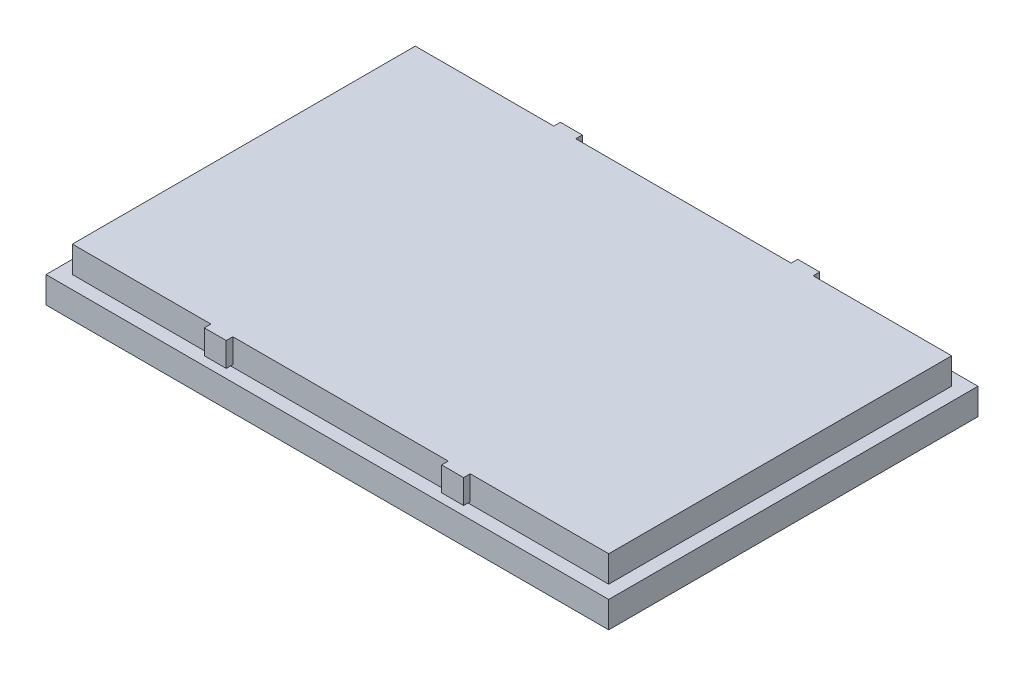
from build123d import *

# Parameters (mm, degrees)
BOSS_EXTRUDE1_START = -72.4
SKETCH1_W           = 25.6
SKETCH1_H           = 1.2
BOSS_EXTRUDE1_DEPTH = 16.8
BOSS_EXTRUDE2_START = -71.8
SKETCH2_W           = 24.4
SKETCH2_H           = 1.21
BOSS_EXTRUDE2_DEPTH = 15.6
BOSS_EXTRUDE3_START = -72.1
SKETCH3_W           = 1
SKETCH3_H           = 1.1
BOSS_EXTRUDE3_DEPTH = 0.31
BOSS_EXTRUDE4_START = -56.21
SKETCH4_W           = 1
SKETCH4_H           = 1.1
BOSS_EXTRUDE4_DEPTH = 0.31
BOSS_EXTRUDE5_START = -72.1
SKETCH5_W           = 1
SKETCH5_H           = 1.1
BOSS_EXTRUDE5_DEPTH = 0.31
BOSS_EXTRUDE6_START = -56.21
SKETCH6_W           = 1
SKETCH6_H           = 1.1
BOSS_EXTRUDE6_DEPTH = 0.31
BOSS_EXTRUDE7_START = -72.5
SKETCH7_W           = 3
SKETCH7_H           = 0.7
BOSS_EXTRUDE7_DEPTH = 0.9


with BuildPart() as part:
    # Sketch1 → Boss-Extrude1 (new body)
    with BuildSketch(Plane.XY.offset(BOSS_EXTRUDE1_START)):
        with Locations((26.8, 0.6)):
            Rectangle(SKETCH1_W, SKETCH1_H)
    extrude(amount=BOSS_EXTRUDE1_DEPTH)

    # Sketch2 → Boss-Extrude2 (add)
    with BuildSketch(Plane.XY.offset(BOSS_EXTRUDE2_START)):
        with Locations((26.8, 1.795)):
            Rectangle(SKETCH2_W, SKETCH2_H)
    extrude(amount=BOSS_EXTRUDE2_DEPTH)

    # Sketch3 → Boss-Extrude3 (add)
    with BuildSketch(Plane.XY.offset(BOSS_EXTRUDE3_START)):
        with Locations((21.4, 1.85)):
            Rectangle(SKETCH3_W, SKETCH3_H)
    extrude(amount=BOSS_EXTRUDE3_DEPTH)

    # Sketch4 → Boss-Extrude4 (add)
    with BuildSketch(Plane.XY.offset(BOSS_EXTRUDE4_START)):
        with Locations((21.4, 1.85)):
            Rectangle(SKETCH4_W, SKETCH4_H)
    extrude(amount=BOSS_EXTRUDE4_DEPTH)

    # Sketch5 → Boss-Extrude5 (add)
    with BuildSketch(Plane.XY.offset(BOSS_EXTRUDE5_START)):
        with Locations((32.2, 1.85)):
            Rectangle(SKETCH5_W, SKETCH5_H)
    extrude(amount=BOSS_EXTRUDE5_DEPTH)

    # Sketch6 → Boss-Extrude6 (add)
    with BuildSketch(Plane.XY.offset(BOSS_EXTRUDE6_START)):
        with Locations((32.2, 1.85)):
            Rectangle(SKETCH6_W, SKETCH6_H)
    extrude(amount=BOSS_EXTRUDE6_DEPTH)


with BuildPart() as body_2:
    # Sketch7 → Boss-Extrude7 (new body)
    with BuildSketch(Plane.XY.offset(BOSS_EXTRUDE7_START)):
        with Locations((26.8, 0.25)):
            Rectangle(SKETCH7_W, SKETCH7_H)
    extrude(amount=BOSS_EXTRUDE7_DEPTH)


with BuildPart() as part_1:
    add(part.part)

    # Combine1: cut body 2
    add(body_2.part, mode=Mode.SUBTRACT)


solid = part_1.part
